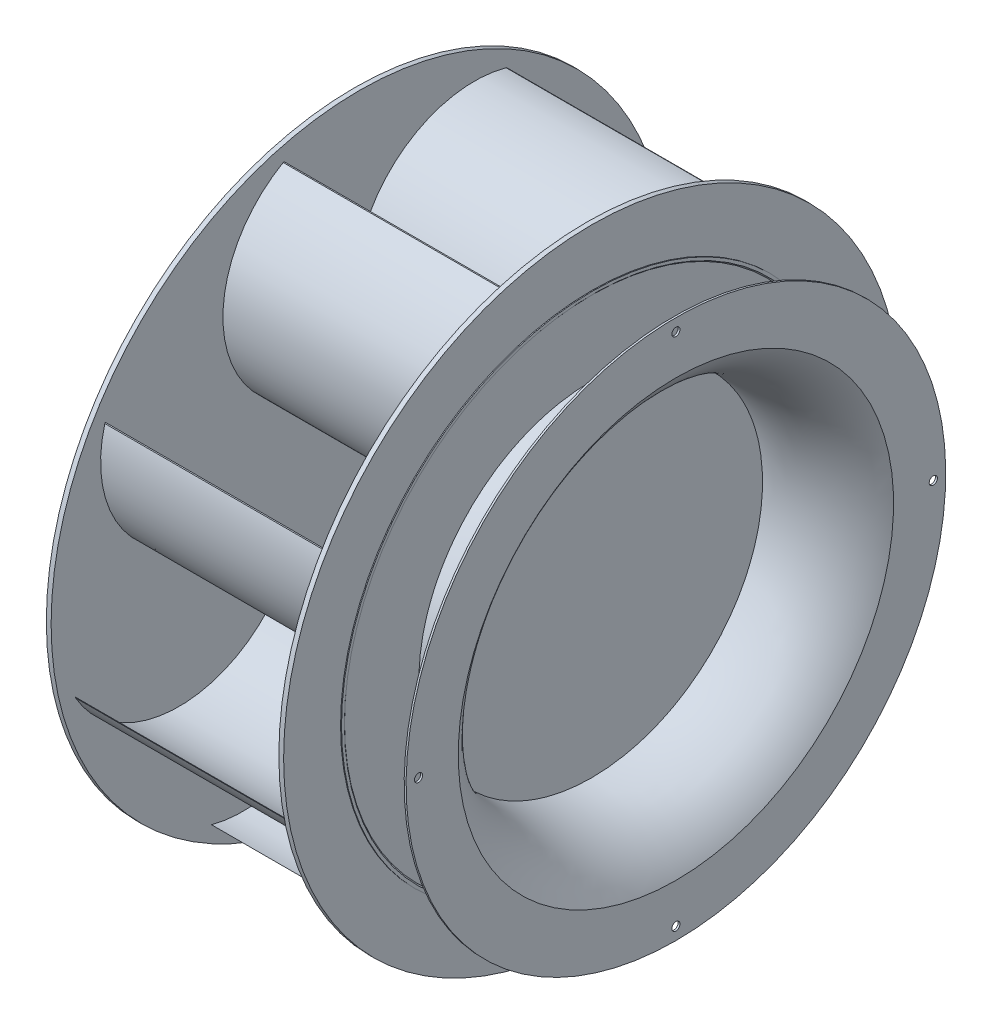
from build123d import *

# Parameters (mm, degrees)
SKETCH2_R         = 322
EXTRUDE1_DEPTH    = 5
SKETCH9_R         = 317
SKETCH9_R_2       = 100
EXTRUDE7_DEPTH    = 3
SKETCH3_R         = 322
EXTRUDE2_DEPTH    = 5
EXTRUDE3_DEPTH    = 243
CIRPATTERN1_COUNT = 8
SKETCH7_R         = 4.25
EXTRUDE5_DEPTH    = 5
CIRPATTERN2_COUNT = 4
SKETCH8_R         = 5
EXTRUDE6_DEPTH    = 90
CIRPATTERN3_COUNT = 8


with BuildPart() as part:
    # Sketch1 → Revolve1 (revolve)
    with BuildSketch(Plane.XY, mode=Mode.PRIVATE) as revolve1_sk:
        with BuildLine():
            Line((0, 0), (0, 109))
            ThreePointArc((0, 109), (1.464466094, 112.535533906), (5, 114))
            Line((5, 114), (70, 114))
            Line((70, 114), (70, 138))
            Line((70, 138), (90, 138))
            Line((90, 138), (90, 98))
            Line((90, 98), (95, 98))
            Line((95, 98), (95, 133))
            Line((95, 133), (105, 133))
            Line((105, 133), (105, 98))
            Line((105, 98), (129, 98))
            Line((129, 98), (129, 0))
            Line((129, 0), (0, 0))
        make_face()
    revolve(revolve1_sk.sketch.rotate(Axis((0, 0, 0), (1, 0, 0)), 90), axis=Axis((0, 0, 0), (1, 0, 0)))

    # Sketch2 → Extrude1 (add)
    with BuildSketch(Plane(origin=(129, 0, 0), x_dir=(0, 0, -1), z_dir=(1, 0, 0))):
        Circle(SKETCH2_R)
    extrude(amount=EXTRUDE1_DEPTH)

    # Sketch9 → Extrude7 (cut)
    with BuildSketch(Plane.ZY.offset(-129)):
        Circle(SKETCH9_R)
        Circle(SKETCH9_R_2, mode=Mode.SUBTRACT)
    extrude(amount=-EXTRUDE7_DEPTH, mode=Mode.SUBTRACT)



with BuildPart() as body_2:
    # Sketch3 → Extrude2 (new body)
    with BuildSketch(Plane(origin=(372, 0, 0), x_dir=(0, 0, -1), z_dir=(1, 0, 0))):
        Circle(SKETCH3_R)
    extrude(amount=EXTRUDE2_DEPTH)


with BuildPart() as part_1:
    add(part.part)

    add(body_2.part)  # Extrude3 merges body 2
    # Sketch4 → Extrude3 (add)
    with BuildSketch(Plane(origin=(134, 0, 0), x_dir=(0, 0, -1), z_dir=(1, 0, 0))):
        with BuildLine():
            Line((0, 112.5), (0.866025404, 112))
            ThreePointArc((0.866025404, 112), (33.143390798, 233.195288477), (154.366025404, 265.369798962))
            Line((154.366025404, 265.369798962), (153.5, 265.869798962))
            ThreePointArc((153.5, 265.869798962), (32.277365394, 233.695288477), (0, 112.5))
        make_face()
    extrude3 = extrude(amount=EXTRUDE3_DEPTH)

    # CirPattern1: Extrude3 ×8 about axis
    cirpattern1_axis = Axis((0, 0, 0), (1, 0, 0))
    for i in range(1, CIRPATTERN1_COUNT):
        add(extrude3.rotate(cirpattern1_axis, i * 360 / CIRPATTERN1_COUNT))

    # Sketch5 → Revolve2 (revolve)
    with BuildSketch(Plane.XY, mode=Mode.PRIVATE) as revolve2_sk:
        with BuildLine():
            Line((377, 262.5), (378, 262.5))
            Line((378, 262.5), (378, 259.5))
            ThreePointArc((378, 259.5), (360.82080716, 222.66845612), (367, 182.5))
            Line((367, 182.5), (367, 181.5))
            ThreePointArc((367, 181.5), (360.011849343, 222.036942392), (377, 259.5))
            Line((377, 259.5), (377, 262.5))
        make_face()
    revolve(revolve2_sk.sketch.rotate(Axis((0, 0, 0), (1, 0, 0)), 90), axis=Axis((0, 0, 0), (1, 0, 0)))

    # Sketch8 → Extrude6 (cut)
    with BuildSketch(Plane(origin=(0, 0, 0), x_dir=(0, 0, -1), z_dir=(1, 0, 0))):
        with Locations(Location((0, 126, 0), (0, 0, 180))):
            Circle(SKETCH8_R)
    extrude6 = extrude(amount=EXTRUDE6_DEPTH, mode=Mode.SUBTRACT)

    # CirPattern3: Extrude6 ×8 about axis
    cirpattern3_axis = Axis((0, 0, 0), (1, 0, 0))
    for i in range(1, CIRPATTERN3_COUNT):
        add(extrude6.rotate(cirpattern3_axis, i * 360 / CIRPATTERN3_COUNT), mode=Mode.SUBTRACT)


with BuildPart() as body_2_2:
    # Sketch6 → Revolve3 (revolve)
    with BuildSketch(Plane.XY, mode=Mode.PRIVATE) as revolve3_sk:
        with BuildLine():
            Line((465, 282), (463, 282))
            Line((463, 282), (463, 227.5))
            ThreePointArc((463, 227.5), (420.763122811, 190.091607925), (365, 181.5))
            Line((365, 181.5), (361, 181.5))
            Line((361, 181.5), (361, 179.5))
            Line((361, 179.5), (365, 179.5))
            ThreePointArc((365, 179.5), (422.265305263, 188.363947369), (465, 227.5))
            Line((465, 227.5), (465, 282))
        make_face()
    revolve(revolve3_sk.sketch.rotate(Axis((0, 0, 0), (1, 0, 0)), 180), axis=Axis((0, 0, 0), (1, 0, 0)))

    # Sketch7 → Extrude5 (cut)
    with BuildSketch(Plane(origin=(465, 0, 0), x_dir=(0, 0, -1), z_dir=(1, 0, 0))):
        with Locations((0, 269)):
            Circle(SKETCH7_R)
    extrude5 = extrude(amount=-EXTRUDE5_DEPTH, mode=Mode.SUBTRACT)

    # CirPattern2: Extrude5 ×4 about axis
    cirpattern2_axis = Axis((0, 0, 0), (1, 0, 0))
    for i in range(1, CIRPATTERN2_COUNT):
        add(extrude5.rotate(cirpattern2_axis, i * 360 / CIRPATTERN2_COUNT), mode=Mode.SUBTRACT)


solid = Compound([part_1.part, body_2_2.part])
